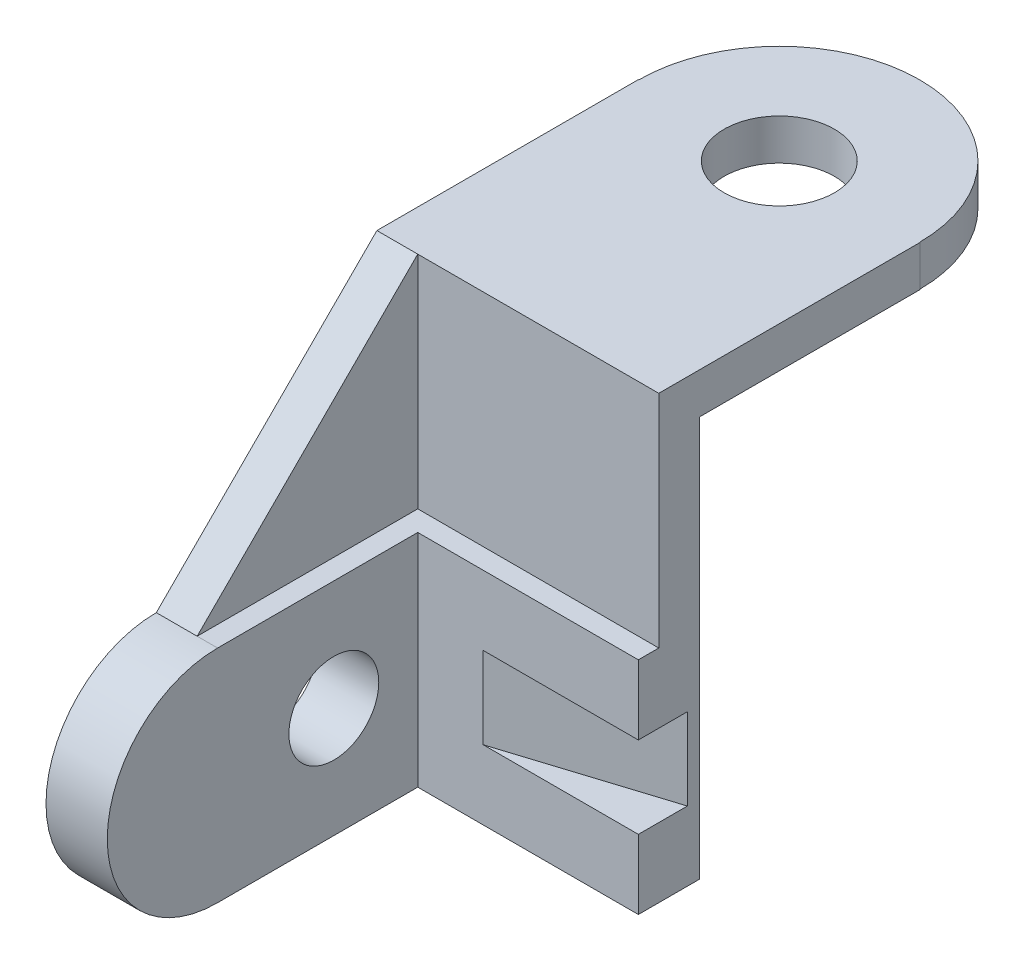
from build123d import *

# Parameters (mm, degrees)
BOSS_EXTRUDE1_DEPTH = 10
SKETCH2_3_R         = 11
BOSS_EXTRUDE2_DEPTH = 15
SKETCH3_W           = 15
SKETCH3_H           = 108
BOSS_EXTRUDE3_DEPTH = 10
BOSS_EXTRUDE4_DEPTH = 54
SKETCH5_W           = 54
SKETCH5_H           = 54
BOSS_EXTRUDE5_DEPTH = 5
SKETCH8_W           = 69
SKETCH8_H           = 10
BOSS_EXTRUDE6_DEPTH = 54
SKETCH10_R          = 34.395117581
SKETCH10_R_2        = 13.5
BOSS_EXTRUDE7_DEPTH = 10
SKETCH11_R          = 13.5
CUT_EXTRUDE1_DEPTH  = 10
SKETCH12_W          = 38
SKETCH12_H          = 20
CUT_EXTRUDE2_DEPTH  = 12
BOSS_EXTRUDE9_DEPTH = 20


with BuildPart() as part:
    # Sketch2 → Boss-Extrude1 (new body)
    with BuildSketch(Plane(origin=(0, 0, 0), x_dir=(0, 0, -1), z_dir=(1, 0, 0))):
        Polygon((-54, 0), (0, 0), (0, 54), align=None)
    extrude(amount=BOSS_EXTRUDE1_DEPTH)

    # Sketch2<3> → Boss-Extrude2 (add)
    with BuildSketch(Plane(origin=(0, 0, 0), x_dir=(0, 0, -1), z_dir=(1, 0, 0))):
        with BuildLine():
            Line((0, -54), (0, 0))
            Line((0, 0), (-54, 0))
            ThreePointArc((-54, 0), (-81, -27), (-54, -54))
            Line((-54, -54), (0, -54))
        make_face()
        with Locations((-25.545100882, -27)):
            Circle(SKETCH2_3_R, mode=Mode.SUBTRACT)
    extrude(amount=BOSS_EXTRUDE2_DEPTH)

    # Sketch3 → Boss-Extrude3 (add)
    with BuildSketch(Plane(origin=(0, 0, 0), x_dir=(-1, 0, 0), z_dir=(0, 0, -1))):
        with Locations((-7.5, 0)):
            Rectangle(SKETCH3_W, SKETCH3_H)
    extrude(amount=BOSS_EXTRUDE3_DEPTH)

    # Sketch4 → Boss-Extrude4 (add)
    with BuildSketch(Plane(origin=(15, 0, 0), x_dir=(0, 0, -1), z_dir=(1, 0, 0))):
        Polygon((10, 54), (0, 54), (0, 0), (0, -54), (10, -54), align=None)
    extrude(amount=BOSS_EXTRUDE4_DEPTH)

    # Sketch5 → Boss-Extrude5 (add)
    with BuildSketch(Plane.XY):
        with Locations((42, -27)):
            Rectangle(SKETCH5_W, SKETCH5_H)
    extrude(amount=BOSS_EXTRUDE5_DEPTH)

    # Sketch8 → Boss-Extrude6 (add)
    with BuildSketch(Plane(origin=(0, 0, -10), x_dir=(-1, 0, 0), z_dir=(0, 0, -1))):
        with Locations((-34.5, 49)):
            Rectangle(SKETCH8_W, SKETCH8_H)
    extrude(amount=BOSS_EXTRUDE6_DEPTH)

    # Sketch10 → Boss-Extrude7 (add)
    with BuildSketch(Plane(origin=(0, 54, 0), x_dir=(1, 0, 0), z_dir=(0, 1, 0))):
        with Locations((34.5, 64)):
            Circle(SKETCH10_R)
        with Locations((34.5, 64)):
            Circle(SKETCH10_R_2, mode=Mode.SUBTRACT)
    extrude(amount=-BOSS_EXTRUDE7_DEPTH)

    # Sketch11 → Cut-Extrude1 (cut)
    with BuildSketch(Plane(origin=(0, 54, 0), x_dir=(1, 0, 0), z_dir=(0, 1, 0))):
        with Locations((34.5, 64)):
            Circle(SKETCH11_R)
    extrude(amount=-CUT_EXTRUDE1_DEPTH, mode=Mode.SUBTRACT)

    # Sketch12 → Cut-Extrude2 (cut)
    with BuildSketch(Plane.XY.offset(5)):
        with Locations((50, -27)):
            Rectangle(SKETCH12_W, SKETCH12_H)
    extrude(amount=-CUT_EXTRUDE2_DEPTH, mode=Mode.SUBTRACT)

    # Sketch14 → Boss-Extrude9 (add)
    with BuildSketch(Plane(origin=(0, -37, 0), x_dir=(1, 0, 0), z_dir=(0, 1, 0))):
        Polygon((31, -5), (69, 7), (31, 7), align=None)
    extrude(amount=BOSS_EXTRUDE9_DEPTH)


solid = part.part
